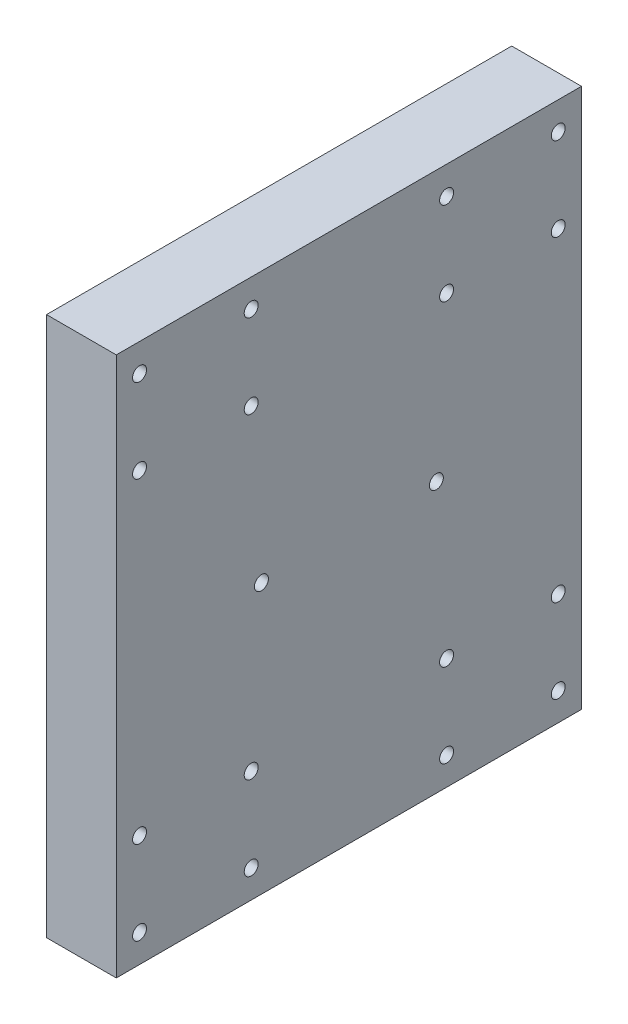
from build123d import *

# Parameters (mm, degrees)
CROQUIS1_W              = 100
CROQUIS1_H              = 116
CROQUIS1_R              = 1.5
SALIENTE_EXTRUIR1_DEPTH = 15
CROQUIS3_R              = 5
CROQUIS3_R_2            = 11
CORTAR_EXTRUIR2_DEPTH   = 7


with BuildPart() as part:
    # Croquis1 → Saliente-Extruir1 (new body)
    with BuildSketch(Plane(origin=(0, 0, 0), x_dir=(0, 0, -1), z_dir=(1, 0, 0))):
        with Locations((50, 58)):
            Rectangle(CROQUIS1_W, CROQUIS1_H)
        with Locations((5, 110)):
            Circle(CROQUIS1_R, mode=Mode.SUBTRACT)
        with Locations((29, 110)):
            Circle(CROQUIS1_R, mode=Mode.SUBTRACT)
        with Locations((5, 92)):
            Circle(CROQUIS1_R, mode=Mode.SUBTRACT)
        with Locations((29, 92)):
            Circle(CROQUIS1_R, mode=Mode.SUBTRACT)
        with Locations(Location((5, 24, 0), (0, 0, 180))):
            Circle(CROQUIS1_R, mode=Mode.SUBTRACT)
        with Locations(Location((29, 24, 0), (0, 0, 180))):
            Circle(CROQUIS1_R, mode=Mode.SUBTRACT)
        with Locations(Location((29, 6, 0), (0, 0, 180))):
            Circle(CROQUIS1_R, mode=Mode.SUBTRACT)
        with Locations(Location((5, 6, 0), (0, 0, 180))):
            Circle(CROQUIS1_R, mode=Mode.SUBTRACT)
        with Locations((31.2, 58)):
            Circle(CROQUIS1_R, mode=Mode.SUBTRACT)
        with Locations((68.8, 58)):
            Circle(CROQUIS1_R, mode=Mode.SUBTRACT)
        with Locations((71, 6)):
            Circle(CROQUIS1_R, mode=Mode.SUBTRACT)
        with Locations((95, 6)):
            Circle(CROQUIS1_R, mode=Mode.SUBTRACT)
        with Locations((95, 24)):
            Circle(CROQUIS1_R, mode=Mode.SUBTRACT)
        with Locations((71, 24)):
            Circle(CROQUIS1_R, mode=Mode.SUBTRACT)
        with Locations(Location((95, 92, 0), (0, 0, 180))):
            Circle(CROQUIS1_R, mode=Mode.SUBTRACT)
        with Locations(Location((71, 92, 0), (0, 0, 180))):
            Circle(CROQUIS1_R, mode=Mode.SUBTRACT)
        with Locations(Location((71, 110, 0), (0, 0, 180))):
            Circle(CROQUIS1_R, mode=Mode.SUBTRACT)
        with Locations(Location((95, 110, 0), (0, 0, 180))):
            Circle(CROQUIS1_R, mode=Mode.SUBTRACT)
    extrude(amount=SALIENTE_EXTRUIR1_DEPTH)

    # Croquis3 → Cortar-Extruir2 (cut)
    with BuildSketch(Plane.ZY):
        with Locations((-53.5, 99)):
            Circle(CROQUIS3_R)
        with Locations((-53.5, 17)):
            Circle(CROQUIS3_R)
        with Locations((-54.5, 58)):
            Circle(CROQUIS3_R_2)
    extrude(amount=-CORTAR_EXTRUIR2_DEPTH, mode=Mode.SUBTRACT)


solid = part.part
